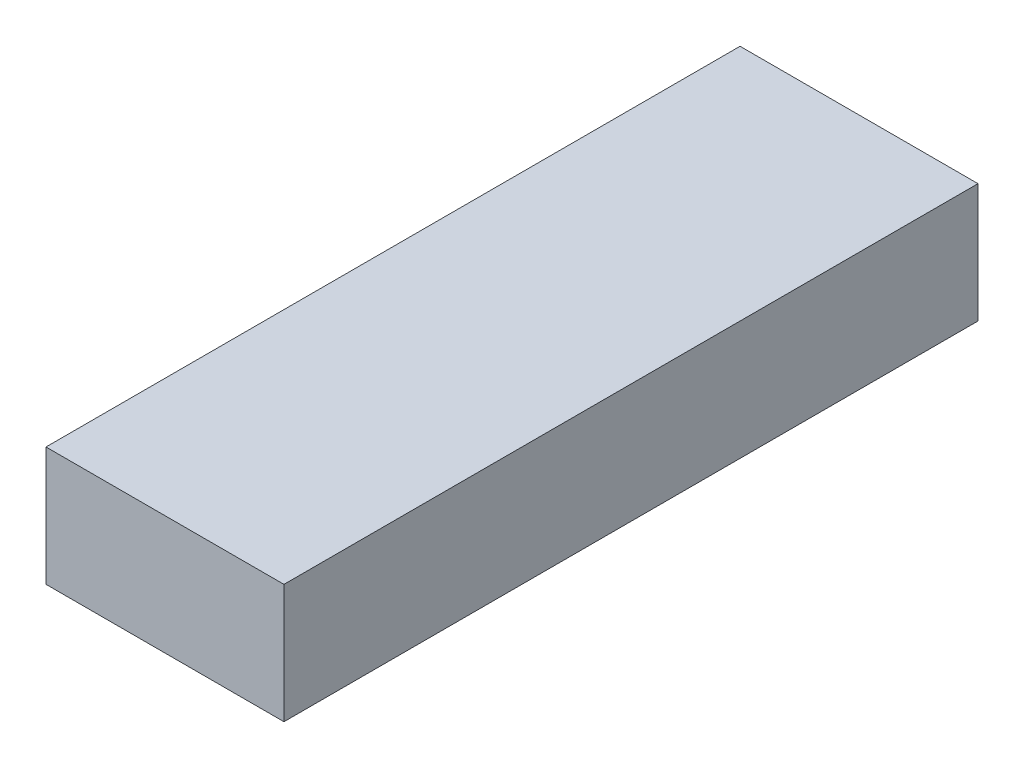
from build123d import *

# Parameters (mm, degrees)
SKETCH1_W           = 15.24
SKETCH1_H           = 7.62
BOSS_EXTRUDE1_DEPTH = 44.45


with BuildPart() as part:
    # Sketch1 → Boss-Extrude1 (new body)
    with BuildSketch(Plane.XY):
        with Locations((-0.292434211, 1.256891736)):
            Rectangle(SKETCH1_W, SKETCH1_H)
    extrude(amount=BOSS_EXTRUDE1_DEPTH)


solid = part.part
